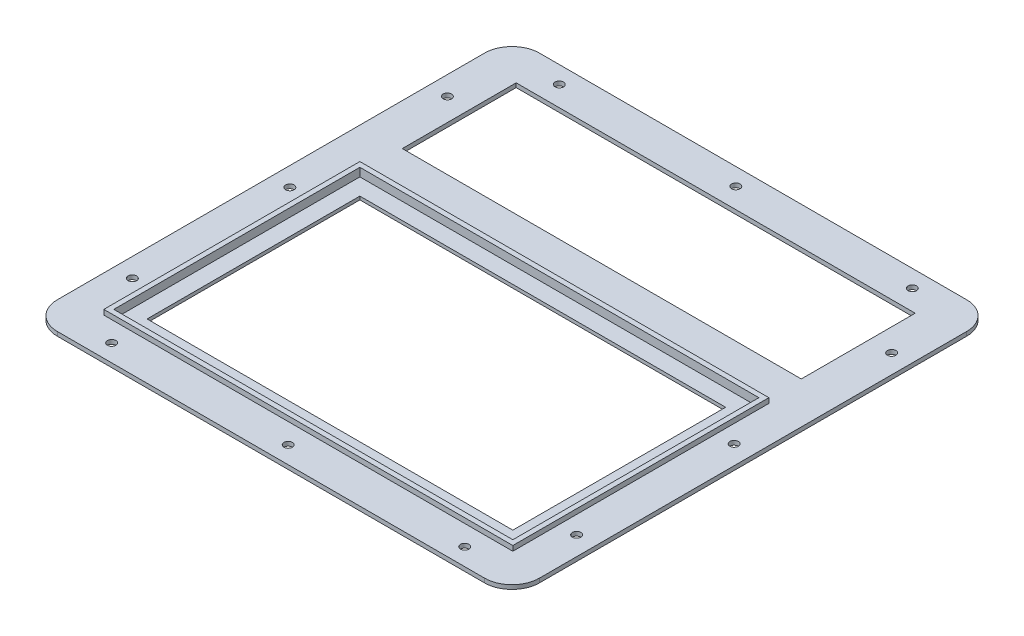
from build123d import *

# Parameters (mm, degrees)
SKETCH1_W           = 246
SKETCH1_H           = 154
BOSS_EXTRUDE1_DEPTH = 7
SKETCH2_W           = 240
SKETCH2_H           = 148
CUT_EXTRUDE1_DEPTH  = 5
SKETCH3_W           = 220
SKETCH3_H           = 128
CUT_EXTRUDE2_DEPTH  = 5
BOSS_EXTRUDE2_START = -3
SKETCH6_W           = 240
SKETCH6_H           = 68.5
SKETCH6_W_2         = 246
SKETCH6_H_2         = 154
BOSS_EXTRUDE2_DEPTH = 2.5
SKETCH8_W           = 39
SKETCH8_H           = 0.3
SKETCH8_W_2         = 12.26
CUT_EXTRUDE5_DEPTH  = 5
SKETCH9_R           = 0.5
CUT_EXTRUDE6_DEPTH  = 5
SKETCH10_R          = 2.54
CUT_EXTRUDE7_DEPTH  = 5


with BuildPart() as part:
    # Sketch1 → Boss-Extrude1 (new body)
    with BuildSketch(Plane(origin=(0, 0, 0), x_dir=(1, 0, 0), z_dir=(0, 1, 0))):
        Rectangle(SKETCH1_W, SKETCH1_H)
    extrude(amount=-BOSS_EXTRUDE1_DEPTH)

    # Sketch2 → Cut-Extrude1 (cut)
    with BuildSketch(Plane(origin=(0, 0, 0), x_dir=(1, 0, 0), z_dir=(0, 1, 0))):
        Rectangle(SKETCH2_W, SKETCH2_H)
    extrude(amount=-CUT_EXTRUDE1_DEPTH, mode=Mode.SUBTRACT)

    # Sketch3 → Cut-Extrude2 (cut)
    with BuildSketch(Plane(origin=(0, -5, 0), x_dir=(1, 0, 0), z_dir=(0, 1, 0))):
        Rectangle(SKETCH3_W, SKETCH3_H)
    extrude(amount=-CUT_EXTRUDE2_DEPTH, mode=Mode.SUBTRACT)

    # Sketch6 → Boss-Extrude2 (add)
    with BuildSketch(Plane(origin=(0, 0, 0), x_dir=(1, 0, 0), z_dir=(0, 1, 0)).offset(BOSS_EXTRUDE2_START)):
        with BuildLine():
            Line((-128.49, -99.5), (128.49, -99.5))
            ThreePointArc((128.49, -99.5), (140.164332957, -94.664332957), (145, -82.99))
            Line((145, -82.99), (145, 173.99))
            ThreePointArc((145, 173.99), (140.164332957, 185.664332957), (128.49, 190.5))
            Line((128.49, 190.5), (-128.49, 190.5))
            ThreePointArc((-128.49, 190.5), (-140.164332957, 185.664332957), (-145, 173.99))
            Line((-145, 173.99), (-145, -82.99))
            ThreePointArc((-145, -82.99), (-140.164332957, -94.664332957), (-128.49, -99.5))
        make_face()
        with Locations((0, 133.75)):
            Rectangle(SKETCH6_W, SKETCH6_H, mode=Mode.SUBTRACT)
        Rectangle(SKETCH6_W_2, SKETCH6_H_2, mode=Mode.SUBTRACT)
    extrude(amount=-BOSS_EXTRUDE2_DEPTH)

    # Sketch8 → Cut-Extrude5 (cut)
    with BuildSketch(Plane(origin=(0, -5, 0), x_dir=(1, 0, 0), z_dir=(0, 1, 0))):
        with Locations((0.5, -72.95)):
            Rectangle(SKETCH8_W, SKETCH8_H)
        with Locations((-36.13, -72.95)):
            Rectangle(SKETCH8_W_2, SKETCH8_H)
    extrude(amount=-CUT_EXTRUDE5_DEPTH, mode=Mode.SUBTRACT)

    # Sketch9 → Cut-Extrude6 (cut)
    with BuildSketch(Plane(origin=(0, -5, 0), x_dir=(1, 0, 0), z_dir=(0, 1, 0))):
        with Locations(Location((119, -46.2, 0), (0, 0, 270))):
            Circle(SKETCH9_R)
        with Locations(Location((119, -42.7, 0), (0, 0, 270))):
            Circle(SKETCH9_R)
    extrude(amount=-CUT_EXTRUDE6_DEPTH, mode=Mode.SUBTRACT)

    # Sketch10 → Cut-Extrude7 (cut)
    with BuildSketch(Plane(origin=(0, -3, 0), x_dir=(1, 0, 0), z_dir=(0, 1, 0))):
        with Locations(Location((-133.604, 140.242, 0), (0, 0, 270))):
            Circle(SKETCH10_R)
        with Locations(Location((-106.172, 180.12, 0), (0, 0, 270))):
            Circle(SKETCH10_R)
        with Locations(Location((-133.604, -49.242, 0), (0, 0, 90))):
            Circle(SKETCH10_R)
        with Locations(Location((-133.604, 45.5, 0), (0, 0, 270))):
            Circle(SKETCH10_R)
        with Locations(Location((0, 180.12, 0), (0, 0, 270))):
            Circle(SKETCH10_R)
        with Locations(Location((0, -89.12, 0), (0, 0, 90))):
            Circle(SKETCH10_R)
        with Locations(Location((-106.172, -89.12, 0), (0, 0, 90))):
            Circle(SKETCH10_R)
        with Locations(Location((106.172, -89.12, 0), (0, 0, 270))):
            Circle(SKETCH10_R)
        with Locations(Location((133.604, 45.5, 0), (0, 0, 90))):
            Circle(SKETCH10_R)
        with Locations(Location((133.604, -49.242, 0), (0, 0, 270))):
            Circle(SKETCH10_R)
        with Locations(Location((106.172, 180.12, 0), (0, 0, 90))):
            Circle(SKETCH10_R)
        with Locations(Location((133.604, 140.242, 0), (0, 0, 90))):
            Circle(SKETCH10_R)
    extrude(amount=-CUT_EXTRUDE7_DEPTH, mode=Mode.SUBTRACT)


solid = part.part
